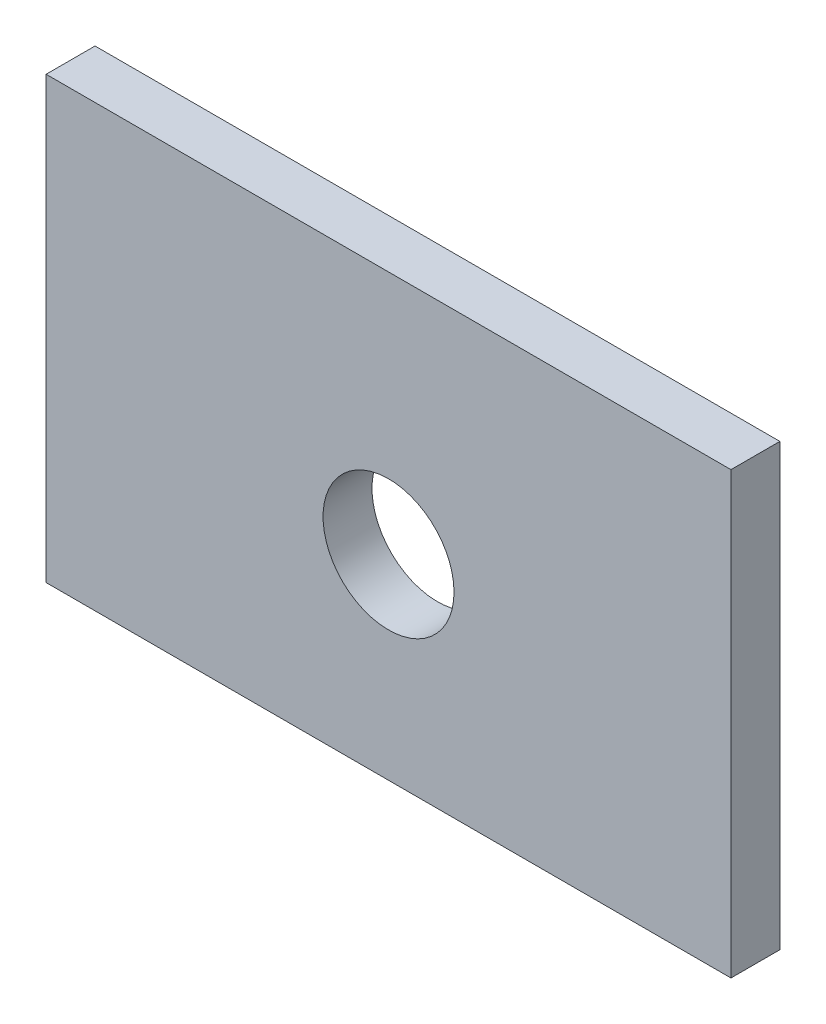
from build123d import *

# Parameters (mm, degrees)
SKETCH1_W           = 88.9
SKETCH1_H           = 57.15
BOSS_EXTRUDE1_DEPTH = 6.35
CUT_EXTRUDE1_REACH  = 55.223
SKETCH2_R           = 8.5


with BuildPart() as part:
    # Sketch1 → Boss-Extrude1 (new body)
    with BuildSketch(Plane.XY):
        Rectangle(SKETCH1_W, SKETCH1_H)
    extrude(amount=BOSS_EXTRUDE1_DEPTH)

    # Sketch2 → Cut-Extrude1 (cut, up to next)
    with BuildSketch(Plane.XY.offset(6.35), mode=Mode.PRIVATE) as cut_extrude1_sk1:
        with Locations((0, -3.175)):
            Circle(SKETCH2_R)
    cut_extrude1_tool1 = extrude(cut_extrude1_sk1.sketch, amount=-CUT_EXTRUDE1_REACH, mode=Mode.PRIVATE) & part.part
    add(cut_extrude1_tool1.solids().sort_by_distance((0, -3.175, 6.35))[0], mode=Mode.SUBTRACT)


solid = part.part
